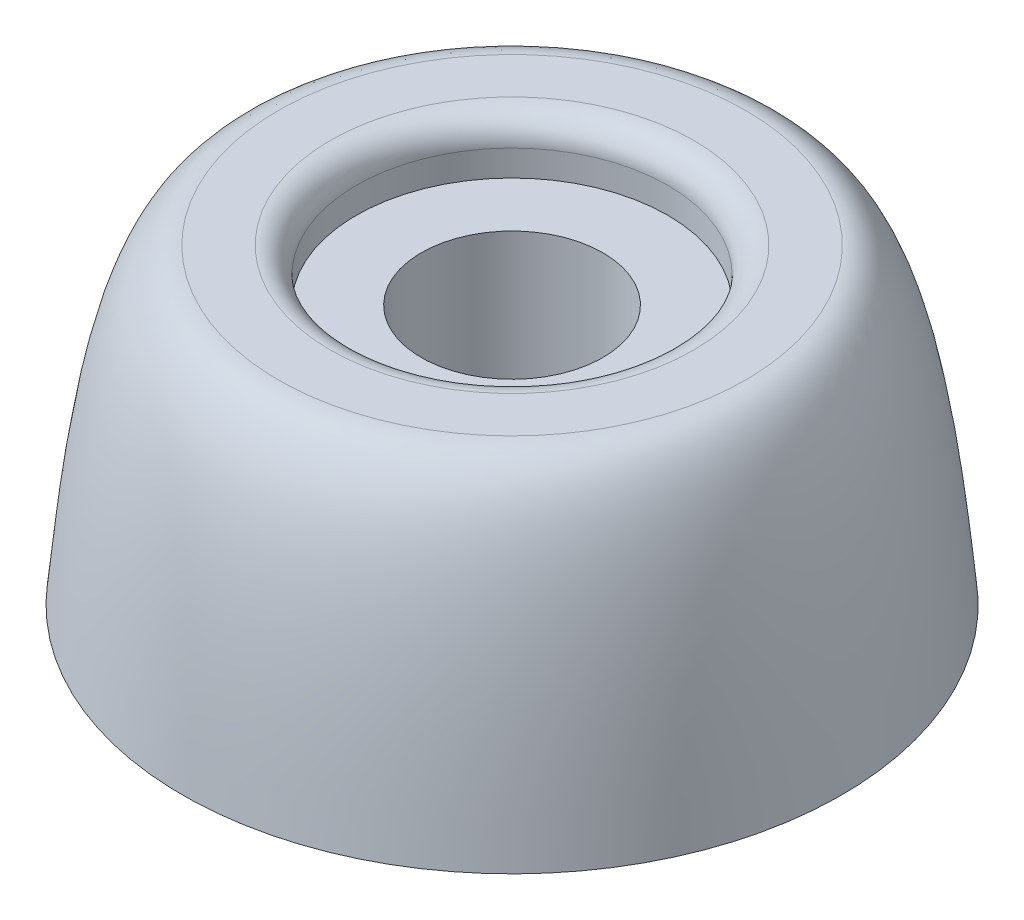
from build123d import *

# Parameters (mm, degrees)
FILLET1_R = 1


with BuildPart() as part:
    # Sketch1 → Revolve1 (revolve)
    with BuildSketch(Plane.XY, mode=Mode.PRIVATE) as revolve1_sk:
        with BuildLine():
            Line((-12.7, 0), (-3.5, 0))
            Line((-3.5, 0), (-3.5, 10))
            Line((-3.5, 10), (-6, 10))
            Line((-6, 10), (-6, 12))
            Line((-6, 12), (-9, 12))
            add(Edge.make_bspline(
                [(-9, 12), (-11.619977791, 11.972530127), (-12.294490853, 4.057777416), (-12.7, 0)],
                knots=[0, 0, 0, 0, 1, 1, 1, 1], degree=3))
        make_face()
    revolve(revolve1_sk.sketch.rotate(Axis((0, 0, 0), (0, 1, 0)), 270), axis=Axis((0, 0, 0), (0, 1, 0)))

    # Fillet1
    fillet1_edges = [part.edges().sort_by_distance(p)[0] for p in [
        (0, 12, 6),
    ]]
    fillet(fillet1_edges, radius=FILLET1_R)


solid = part.part
